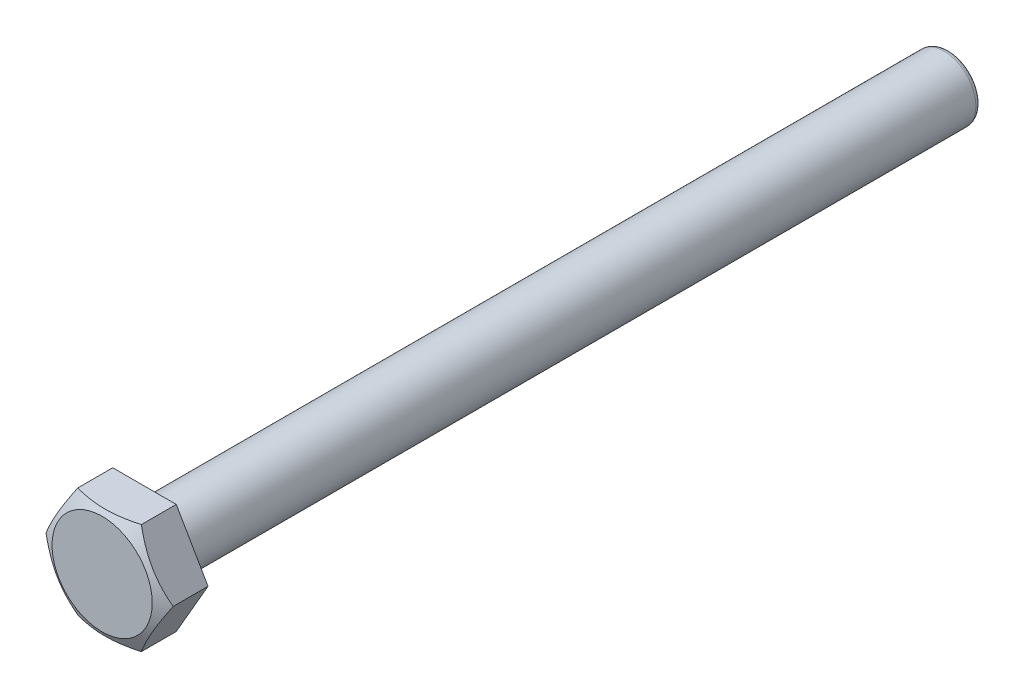
from build123d import *

# Parameters (mm, degrees)
BOSS_EXTRUDE1_DEPTH = 4
SKETCH5_R           = 3
BOSS_EXTRUDE2_DEPTH = 76
FILLET1_R           = 0.5


with BuildPart() as part:
    # Sketch1 → Boss-Extrude1 (new body)
    with BuildSketch(Plane.XY):
        Polygon((6, 0), (3, 5.196152423), (-3, 5.196152423), (-6, 0), (-3, -5.196152423), (3, -5.196152423), align=None)
    extrude(amount=BOSS_EXTRUDE1_DEPTH)

    # Sketch4 → Cut-Revolve1 (revolve, cut)
    with BuildSketch(Plane(origin=(0, 0, 0), x_dir=(0, 0, -1), z_dir=(0.8660254037844362, 0.5000000000000042, 0)), mode=Mode.PRIVATE) as cut_revolve1_sk:
        Polygon((-4, 4.729715048), (-3.3, 6), (-4, 6), align=None)
    revolve(cut_revolve1_sk.sketch.rotate(Axis((0, 0, 6.225223698), (0, 0, -1)), 120), axis=Axis((0, 0, 6.225223698), (0, 0, -1)), mode=Mode.SUBTRACT)

    # Sketch5 → Boss-Extrude2 (add)
    with BuildSketch(Plane(origin=(0, 0, 0), x_dir=(-1, 0, 0), z_dir=(0, 0, -1))):
        Circle(SKETCH5_R)
    extrude(amount=BOSS_EXTRUDE2_DEPTH)

    # Fillet1
    fillet1_edges = [part.edges().sort_by_distance(p)[0] for p in [
        (3, 0, -76),
    ]]
    fillet(fillet1_edges, radius=FILLET1_R)


solid = part.part
